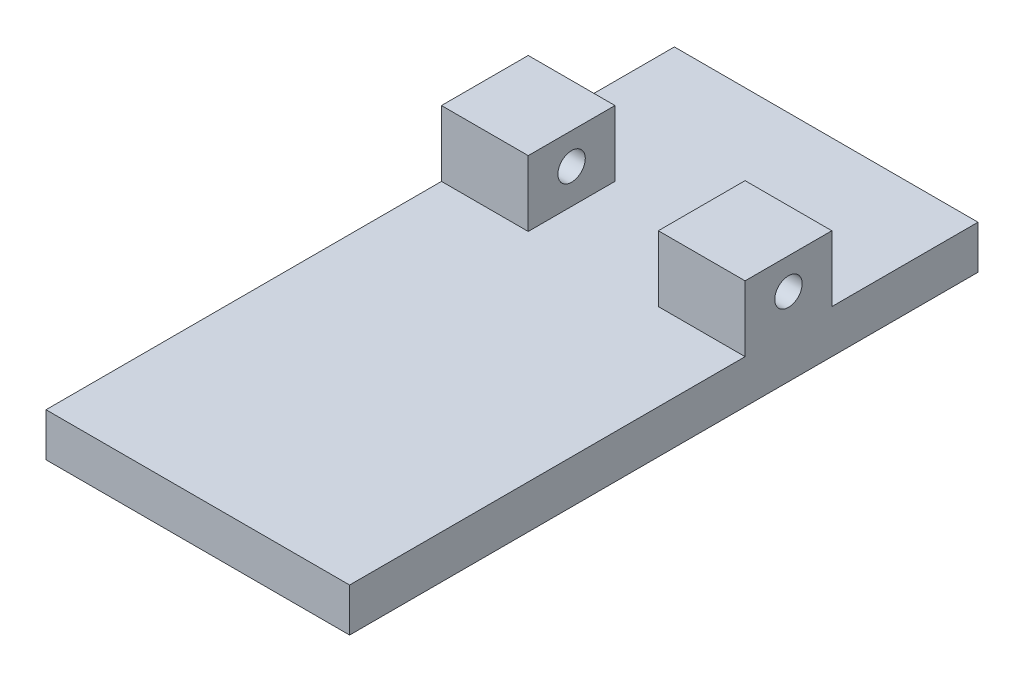
from build123d import *

# Parameters (mm, degrees)
SKETCH1_W             = 22.225
SKETCH1_H             = 46
BOSS_EXTRUDE1_DEPTH   = 3.175
SKETCH2_W             = 6.35
SKETCH2_H             = 6.35
BOSS_EXTRUDE2_DEPTH   = 4.80949
F_1_0MM_DOWEL_HOLE1_D = 2.005


with BuildPart() as part:
    # Sketch1 → Boss-Extrude1 (new body)
    with BuildSketch(Plane(origin=(0, 0, 0), x_dir=(1, 0, 0), z_dir=(0, 1, 0))):
        with Locations((0, 2.4)):
            Rectangle(SKETCH1_W, SKETCH1_H)
    extrude(amount=BOSS_EXTRUDE1_DEPTH)

    # Sketch2 → Boss-Extrude2 (add)
    with BuildSketch(Plane(origin=(0, 3.175, 0), x_dir=(1, 0, 0), z_dir=(0, 1, 0))):
        with Locations((7.9375, 11.525)):
            Rectangle(SKETCH2_W, SKETCH2_H)
    boss_extrude2 = extrude(amount=BOSS_EXTRUDE2_DEPTH)

    # Ø1.0mm Dowel Hole1 (through all)
    with Locations(Plane.ZY.offset(-4.7625)):
        with Locations((-11.525, 5.715)):
            f_1_0mm_dowel_hole1 = Hole(F_1_0MM_DOWEL_HOLE1_D / 2)

    # Mirror1: Boss-Extrude2, Ø1.0mm Dowel Hole1 across plane
    add(boss_extrude2.mirror(Plane.ZY))
    add(f_1_0mm_dowel_hole1.mirror(Plane.ZY), mode=Mode.SUBTRACT)


solid = part.part
